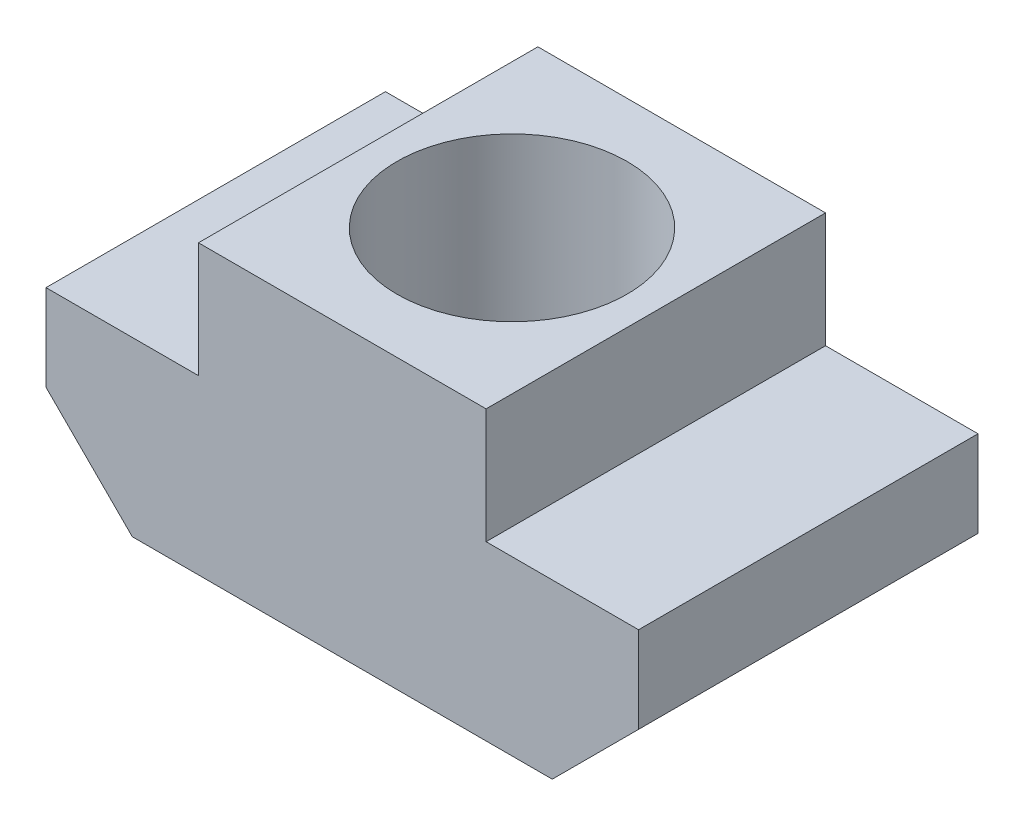
from build123d import *

# Parameters (mm, degrees)
SKETCH_1_W          = 2.65
SKETCH_1_H          = 5.9
EXTRUDE_3_DEPTH     = 3
EXTRUDE_3_2_DEPTH   = 3
SKETCH_1_3_W        = 5
SKETCH_1_3_H        = 5.9
SKETCH_1_3_R        = 2
EXTRUDE_4_DEPTH     = 5
CUT_EXTRUDE_1_DEPTH = 10.2915284


with BuildPart() as part:
    # 草图1 → 凸台-拉伸3 (new body)
    with BuildSketch(Plane(origin=(0, 0, 0), x_dir=(1, 0, 0), z_dir=(0, 1, 0))):
        with Locations((3.825, 0)):
            Rectangle(SKETCH_1_W, SKETCH_1_H)
    extrude(amount=EXTRUDE_3_DEPTH)



with BuildPart() as body_2:
    # 草图1 → Extrude 3 2 (new body)
    with BuildSketch(Plane(origin=(0, 0, 0), x_dir=(1, 0, 0), z_dir=(0, 1, 0))):
        with Locations((-3.825, 0)):
            Rectangle(SKETCH_1_W, SKETCH_1_H)
    extrude(amount=EXTRUDE_3_2_DEPTH)


with BuildPart() as part_1:
    add(part.part)

    add(body_2.part)  # 凸台-拉伸4 merges body 2
    # 草图1<3> → 凸台-拉伸4 (add)
    with BuildSketch(Plane(origin=(0, 0, 0), x_dir=(1, 0, 0), z_dir=(0, 1, 0))):
        Rectangle(SKETCH_1_3_W, SKETCH_1_3_H)
        Circle(SKETCH_1_3_R, mode=Mode.SUBTRACT)
    extrude(amount=EXTRUDE_4_DEPTH)

    # 草图2 → 切除-拉伸1 (cut, through all)
    with BuildSketch(Plane.XY.offset(2.95)):
        Polygon((-5.15, 1.5), (-3.65, 0), (-5.15, 0), align=None)
        Polygon((5.15, 1.5), (3.65, 0), (5.15, 0), align=None)
    extrude(amount=-CUT_EXTRUDE_1_DEPTH, mode=Mode.SUBTRACT)


solid = part_1.part
